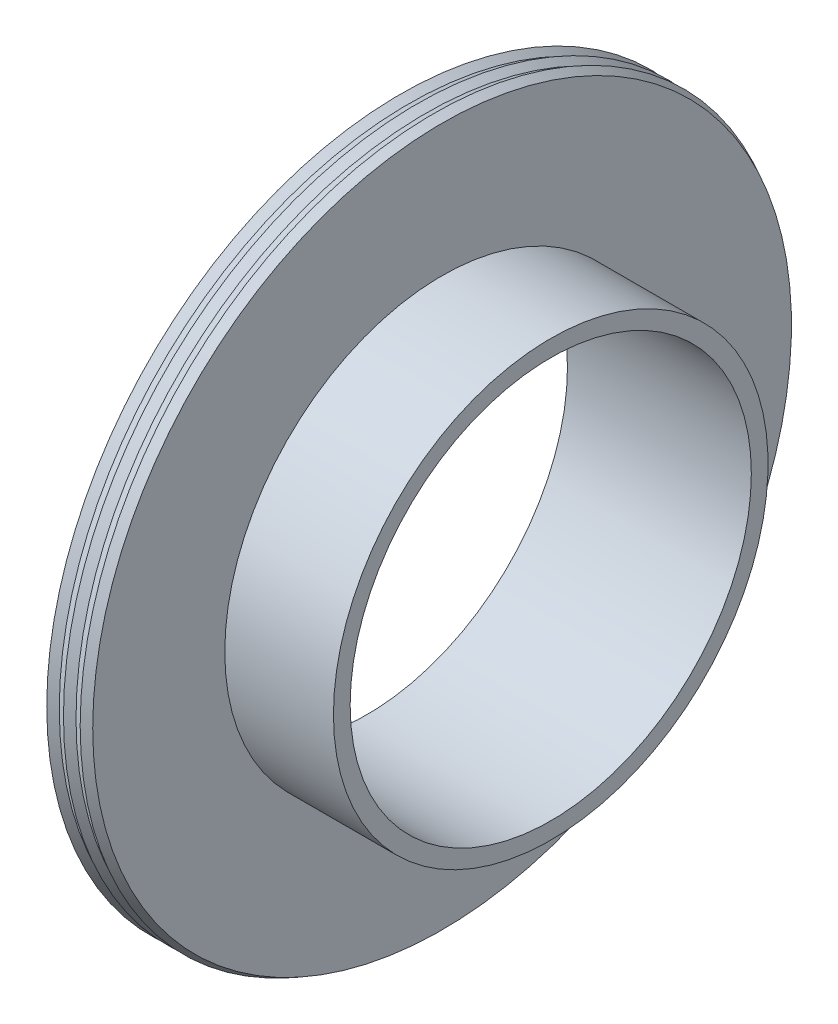
from build123d import *


with BuildPart() as part:
    # 草图1 → 旋转1 (revolve)
    with BuildSketch(Plane.XY, mode=Mode.PRIVATE) as revolve_1_sk:
        Polygon((0, 26), (0, 24), (22, 24), (22, 26), (9, 26), (9, 41.8), (8, 42.3), (7, 41.8), (6, 42.3), (5, 41.8), (4, 42.3), (4, 26), align=None)
    revolve(revolve_1_sk.sketch.rotate(Axis((-59.659258107, 0, 0), (1, 0, 0)), 90), axis=Axis((-59.659258107, 0, 0), (1, 0, 0)))


solid = part.part
